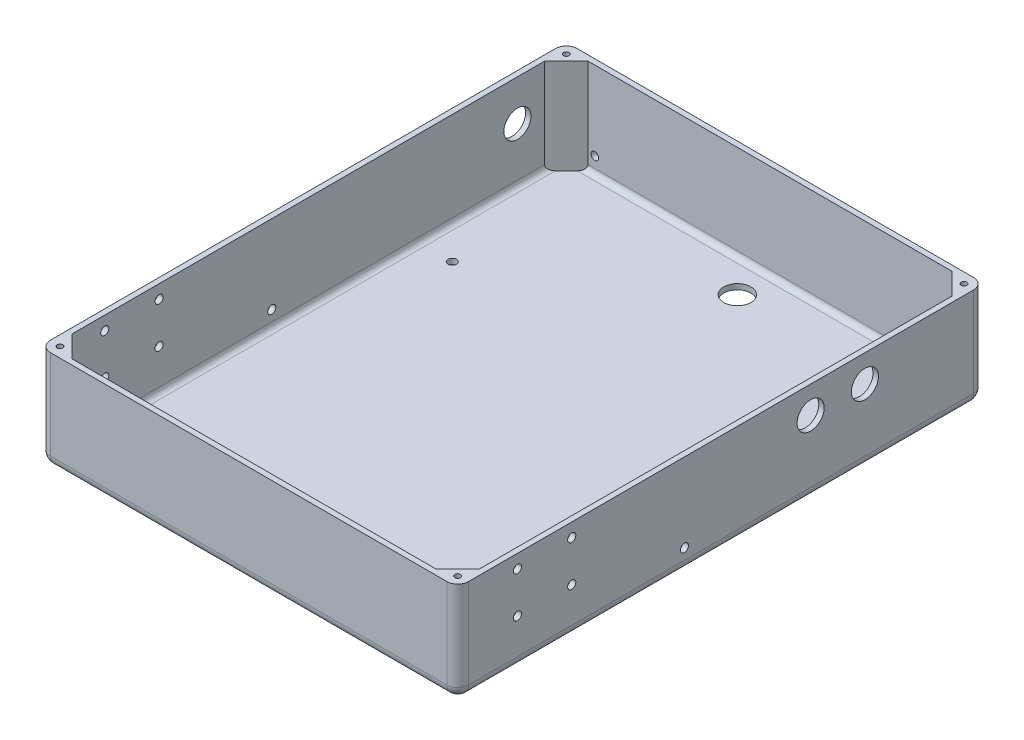
from build123d import *

# Parameters (mm, degrees)
SKETCH1_W                           = 190.5
SKETCH1_H                           = 241.3
BOSS_EXTRUDE1_DEPTH                 = 44.45
FILLET1_R                           = 2.54
SHELL1_T                            = 2.54
HOLE_A_D                            = 4
BOSS_EXTRUDE3_REACH                 = 166.155
MIRROR3_COPY_1_REACH                = 166.155
COVER_HOLES_D                       = 2.64668
COVER_HOLES_DEPTH                   = 12.7
COVER_HOLES_TIP                     = 0.795142892
HOLE_FOR_WIRING_D                   = 12.7
HOLE_TO_OUTSIDE_WIRING_D            = 12.7
HOLE_TO_OUTSIDE_WIRING_DEPTH        = 2.54
HOLE_TO_OUTSIDE_WIRING_TIP          = 3.815464931
F_9_64_0_15_DIAMETER_HOLE1_D        = 3.81
F_9_64_0_14063_DIAMETER_HOLE2_D     = 3.572002
F_9_64_0_14063_DIAMETER_HOLE2_DEPTH = 2.54
F_9_64_0_14063_DIAMETER_HOLE2_TIP   = 1.073137666
ANTENNA_HOLES_D                     = 12.7
ANTENNA_HOLES_DEPTH                 = 2.54
ANTENNA_HOLES_TIP                   = 3.815464931
F_1_8_0_15_DIAMETER_HOLE1_D         = 3.81


with BuildPart() as part:
    # Sketch1 → Boss-Extrude1 (new body)
    with BuildSketch(Plane(origin=(0, 0, 0), x_dir=(1, 0, 0), z_dir=(0, 1, 0))):
        Rectangle(SKETCH1_W, SKETCH1_H)
    extrude(amount=BOSS_EXTRUDE1_DEPTH)

    # Fillet1
    fillet1_edges = [part.edges().sort_by_distance(p)[0] for p in [
        (0, 0, -120.65),
        (95.25, 0, 0),
        (0, 0, 120.65),
        (-95.25, 0, 0),
        (-95.25, 22.225, -120.65),
        (95.25, 22.225, -120.65),
        (95.25, 22.225, 120.65),
        (-95.25, 22.225, 120.65),
    ]]
    fillet(fillet1_edges, radius=FILLET1_R)

    # Shell1
    shell1_openings = [part.faces().sort_by_distance(p)[0] for p in [
        (0, 44.45, 0),
    ]]
    offset(amount=SHELL1_T, openings=shell1_openings, kind=Kind.INTERSECTION)

    # Hole A (through all)
    with Locations(Plane(origin=(0, 0, 0), x_dir=(1, 0, 0), z_dir=(0, 1, 0))):
        with Locations((-80.01, 52.07), (74.91000004, 52.07), (-80.01, -105.41), (52.07, -105.41)):
            Hole(HOLE_A_D / 2)

    # Boss-Extrude3: up to this face of the body (flat: up to its plane)
    boss_extrude3_end = Plane(part.part.faces().sort_by_distance((0.0094902, 0, -0.030642085))[0])
    # Sketch25 → Boss-Extrude3 (add, up to the picked face)
    with BuildSketch(Plane(origin=(0, 44.45, 0), x_dir=(1, 0, 0), z_dir=(0, 1, 0)), mode=Mode.PRIVATE) as boss_extrude3_sk1:
        Polygon((85.09, 120.65), (95.25, 110.49), (95.25, 120.65), align=None)
    boss_extrude3_tool1 = split(extrude(boss_extrude3_sk1.sketch, amount=-BOSS_EXTRUDE3_REACH, mode=Mode.PRIVATE), bisect_by=boss_extrude3_end, keep=Keep.BOTH, mode=Mode.PRIVATE)
    boss_extrude3 = boss_extrude3_tool1.solids().sort_by(Axis((91.863333, 44.45, -117.263333), (0, -1, 0)))[0]
    add(boss_extrude3)

    # Mirror2: Boss-Extrude3 across plane
    add(boss_extrude3.mirror(Plane.XY))

    # Mirror3: Boss-Extrude3 across plane
    add(boss_extrude3.mirror(Plane(origin=(0, 0, 0), x_dir=(0, 0, 1), z_dir=(1, 0, 0))))

    # Mirror3 copy 1: up to this face of the body (flat: up to its plane)
    mirror3_copy_1_end = Plane(part.part.faces().sort_by_distance((-0.0094902, 0, 0.030642085))[0])
    # Mirror3 copy 1 sketch → Mirror3 copy 1 (add, up to the picked face)
    with BuildSketch(Plane(origin=(0, 44.45, 0), x_dir=(-1, 0, 0), z_dir=(0, 1, 0)), mode=Mode.PRIVATE) as mirror3_copy_1_sk1:
        Polygon((85.09, 120.65), (95.25, 110.49), (95.25, 120.65), align=None)
    mirror3_copy_1_tool1 = split(extrude(mirror3_copy_1_sk1.sketch, amount=-MIRROR3_COPY_1_REACH, mode=Mode.PRIVATE), bisect_by=mirror3_copy_1_end, keep=Keep.BOTH, mode=Mode.PRIVATE)
    add(mirror3_copy_1_tool1.solids().sort_by(Axis((-91.863333, 44.45, 117.263333), (0, -1, 0)))[0])

    # Cover Holes
    with Locations(Plane(origin=(0, 44.45, 0), x_dir=(1, 0, 0), z_dir=(0, 1, 0))):
        with Locations((-93.0275, 118.4275), (-93.0275, -118.4275), (93.0275, -118.4275), (93.0275, 118.4275)):
            Hole(COVER_HOLES_D / 2, depth=COVER_HOLES_DEPTH)
            with Locations((0, 0, -(COVER_HOLES_DEPTH + COVER_HOLES_TIP / 2))):  # 118° drill point
                Cone(0, COVER_HOLES_D / 2, COVER_HOLES_TIP, mode=Mode.SUBTRACT)

    # Hole for wiring (through all)
    with Locations(Plane(origin=(0, 0, 0), x_dir=(1, 0, 0), z_dir=(0, 1, 0))):
        with Locations((0, 105.41)):
            Hole(HOLE_FOR_WIRING_D / 2)

    # Hole to outside wiring
    with Locations(Plane.ZY.offset(97.79)):
        with Locations((-97.79, 25.4)):
            Hole(HOLE_TO_OUTSIDE_WIRING_D / 2, depth=HOLE_TO_OUTSIDE_WIRING_DEPTH)
            with Locations((0, 0, -(HOLE_TO_OUTSIDE_WIRING_DEPTH + HOLE_TO_OUTSIDE_WIRING_TIP / 2))):  # 118° drill point
                Cone(0, HOLE_TO_OUTSIDE_WIRING_D / 2, HOLE_TO_OUTSIDE_WIRING_TIP, mode=Mode.SUBTRACT)

    # 9/64 (0.15) Diameter Hole1 (through all)
    with Locations(Plane(origin=(97.79, 0, 0), x_dir=(0, 0, -1), z_dir=(1, 0, 0))):
        with Locations((-17.145, 7.62)):
            Hole(F_9_64_0_15_DIAMETER_HOLE1_D / 2)

    # 9/64 (0.14063) Diameter Hole2
    with Locations(Plane(origin=(0, 0, -123.19), x_dir=(-1, 0, 0), z_dir=(0, 0, -1))):
        with Locations((-81.915, 7.62), (81.915, 7.62)):
            Hole(F_9_64_0_14063_DIAMETER_HOLE2_D / 2, depth=F_9_64_0_14063_DIAMETER_HOLE2_DEPTH)
            with Locations((0, 0, -(F_9_64_0_14063_DIAMETER_HOLE2_DEPTH + F_9_64_0_14063_DIAMETER_HOLE2_TIP / 2))):  # 118° drill point
                Cone(0, F_9_64_0_14063_DIAMETER_HOLE2_D / 2, F_9_64_0_14063_DIAMETER_HOLE2_TIP, mode=Mode.SUBTRACT)

    # Antenna Holes
    with Locations(Plane(origin=(97.79, 0, 0), x_dir=(0, 0, -1), z_dir=(1, 0, 0))):
        with Locations((67.31, 31.75), (41.91, 31.75)):
            Hole(ANTENNA_HOLES_D / 2, depth=ANTENNA_HOLES_DEPTH)
            with Locations((0, 0, -(ANTENNA_HOLES_DEPTH + ANTENNA_HOLES_TIP / 2))):  # 118° drill point
                Cone(0, ANTENNA_HOLES_D / 2, ANTENNA_HOLES_TIP, mode=Mode.SUBTRACT)

    # 1/8 (0.15) Diameter Hole1 (through all)
    with Locations(Plane(origin=(97.79, 0, 0), x_dir=(0, 0, -1), z_dir=(1, 0, 0))):
        with Locations((-95.25, 38.1), (-69.85, 38.1), (-95.25, 19.05), (-69.85, 19.05)):
            Hole(F_1_8_0_15_DIAMETER_HOLE1_D / 2)


solid = part.part
